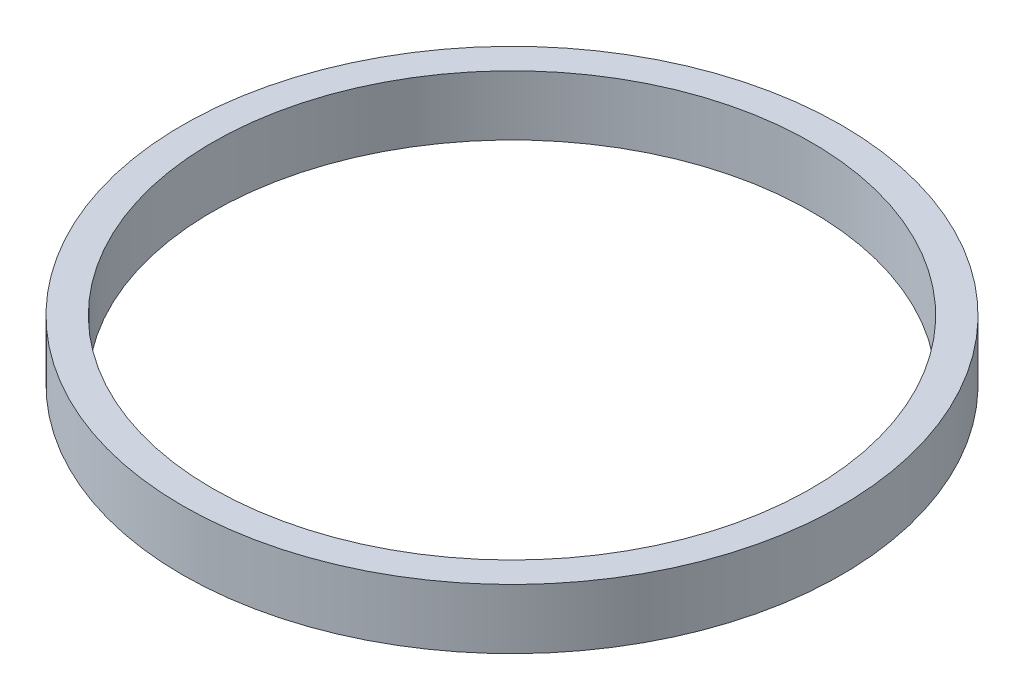
from build123d import *

# Parameters (mm, degrees)
SKETCH1_R           = 33
SKETCH1_R_2         = 30
BOSS_EXTRUDE1_DEPTH = 6


with BuildPart() as part:
    # Sketch1 → Boss-Extrude1 (new body)
    with BuildSketch(Plane(origin=(0, 0, 0), x_dir=(1, 0, 0), z_dir=(0, 1, 0))):
        with Locations(Location((0, 0, 0), (0, 0, 270))):
            Circle(SKETCH1_R)
        with Locations(Location((0, 0, 0), (0, 0, 270))):
            Circle(SKETCH1_R_2, mode=Mode.SUBTRACT)
    extrude(amount=BOSS_EXTRUDE1_DEPTH)


solid = part.part
